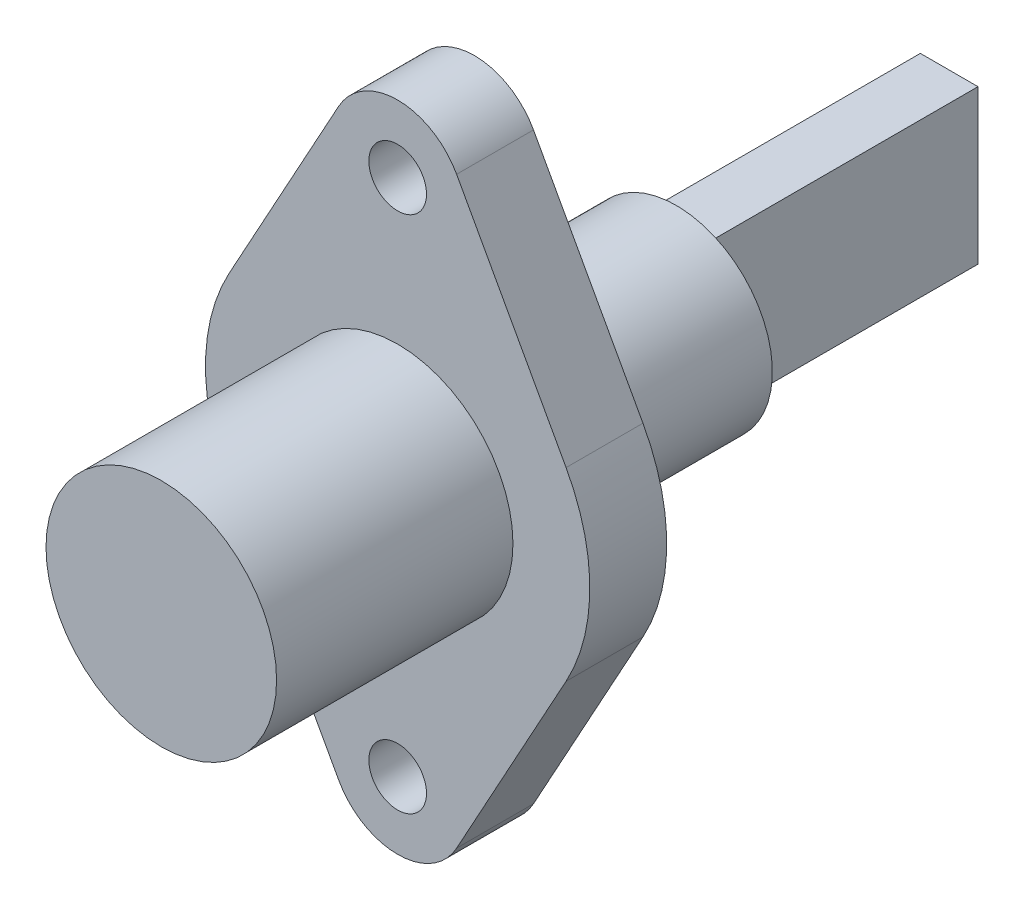
from build123d import *

# Parameters (mm, degrees)
SKETCH1_R           = 3.5
SKETCH1_R_2         = 1.5
SKETCH1_R_3         = 10
BOSS_EXTRUDE1_DEPTH = 4
SKETCH2_R           = 6
BOSS_EXTRUDE2_DEPTH = 12.3
SKETCH3_R           = 7.5
BOSS_EXTRUDE3_DEPTH = 0.5
SKETCH4_W           = 3
SKETCH4_H           = 8
BOSS_EXTRUDE4_DEPTH = 24.2
SKETCH5_R           = 5
BOSS_EXTRUDE5_DEPTH = 10


with BuildPart() as part:
    # Sketch1 → Boss-Extrude1 (new body)
    # profile 1 of 7: a face of its own
    with BuildSketch(Plane.XY):
        with Locations((0, -13.5)):
            Circle(SKETCH1_R)
        with Locations((0, -13.5)):
            Circle(SKETCH1_R_2, mode=Mode.SUBTRACT)
    # profile 2 of 7: a face of its own
    with BuildSketch(Plane.XY):
        with BuildLine():
            ThreePointArc((8.764562642, -4.814814815), (5.091750776, -8.606629656), (9e-09, -10))
            ThreePointArc((9e-09, -10), (2.474873737, -11.025126269), (3.5, -13.5))
            ThreePointArc((3.5, -13.5), (3.390176193, -14.369888143), (3.067596925, -15.185185185))
            Line((3.067596925, -15.185185185), (8.764562642, -4.814814815))
        make_face()
    # profile 3 of 7: a face of its own
    with BuildSketch(Plane.XY):
        Circle(SKETCH1_R_3)
    # profile 4 of 7: a face of its own
    with BuildSketch(Plane.XY):
        with BuildLine():
            Line((8.764562642, 4.814814815), (3.067596925, 15.185185185))
            ThreePointArc((3.067596925, 15.185185185), (3.390176193, 14.369888143), (3.5, 13.5))
            ThreePointArc((3.5, 13.5), (2.474873734, 11.025126266), (0, 10))
            ThreePointArc((0, 10), (5.091750772, 8.606629658), (8.764562642, 4.814814815))
        make_face()
    # profile 5 of 7: a face of its own
    with BuildSketch(Plane.XY):
        with Locations((0, 13.5)):
            Circle(SKETCH1_R)
        with Locations((0, 13.5)):
            Circle(SKETCH1_R_2, mode=Mode.SUBTRACT)
    # profile 6 of 7: a face of its own
    with BuildSketch(Plane.XY):
        with BuildLine():
            ThreePointArc((0, 10), (-3.01232038, 11.71788723), (-3.067596925, 15.185185185))
            Line((-3.067596925, 15.185185185), (-8.764562642, 4.814814815))
            ThreePointArc((-8.764562642, 4.814814815), (-5.091750772, 8.606629658), (0, 10))
        make_face()
    # profile 7 of 7: a face of its own
    with BuildSketch(Plane.XY):
        with BuildLine():
            ThreePointArc((9e-09, -10), (-5.091750768, -8.606629661), (-8.764562642, -4.814814815))
            Line((-8.764562642, -4.814814815), (-3.067596925, -15.185185185))
            ThreePointArc((-3.067596925, -15.185185185), (-3.012320378, -11.717887226), (9e-09, -10))
        make_face()
    extrude(amount=BOSS_EXTRUDE1_DEPTH)

    # Sketch2 → Boss-Extrude2 (add)
    with BuildSketch(Plane.XY.offset(4)):
        Circle(SKETCH2_R)
    extrude(amount=BOSS_EXTRUDE2_DEPTH)

    # Sketch3 → Boss-Extrude3 (add)
    with BuildSketch(Plane(origin=(0, 0, 0), x_dir=(-1, 0, 0), z_dir=(0, 0, -1))):
        with Locations(Location((0, 0, 0), (0, 0, 180))):
            Circle(SKETCH3_R)
    extrude(amount=BOSS_EXTRUDE3_DEPTH)

    # Sketch4 → Boss-Extrude4 (add)
    with BuildSketch(Plane(origin=(0, 0, -0.5), x_dir=(-1, 0, 0), z_dir=(0, 0, -1))):
        Rectangle(SKETCH4_W, SKETCH4_H)
    extrude(amount=BOSS_EXTRUDE4_DEPTH)

    # Sketch5 → Boss-Extrude5 (add)
    with BuildSketch(Plane(origin=(0, 0, -0.5), x_dir=(-1, 0, 0), z_dir=(0, 0, -1))):
        Circle(SKETCH5_R)
    extrude(amount=BOSS_EXTRUDE5_DEPTH)


solid = part.part
